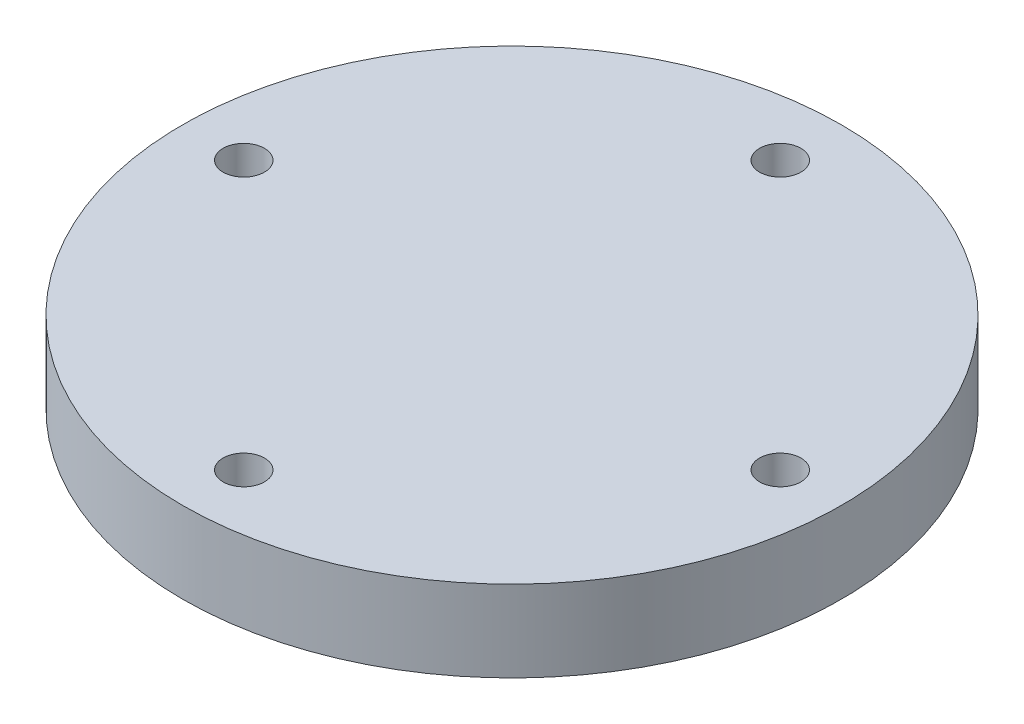
from build123d import *

# Parameters (mm, degrees)
SKETCH_1_R          = 21.5
EXTRUDE_1_DEPTH     = 5.3
CUT_EXTRUDE_1_REACH = 32.864
SKETCH_2_R          = 1.35


with BuildPart() as part:
    # 草图1 → 凸台-拉伸1 (new body)
    with BuildSketch(Plane(origin=(0, 0, 0), x_dir=(1, 0, 0), z_dir=(0, 1, 0))):
        with Locations(Location((0, 0, 0), (0, 0, 270))):
            Circle(SKETCH_1_R)
    extrude(amount=EXTRUDE_1_DEPTH)

    # 草图2 → 切除-拉伸1 (cut, up to next)
    with BuildSketch(Plane(origin=(0, 5.3, 0), x_dir=(1, 0, 0), z_dir=(0, 1, 0)), mode=Mode.PRIVATE) as cut_extrude_1_sk1:
        with Locations(Location((-17.5, 0, 0), (0, 0, 270))):
            Circle(SKETCH_2_R)
    cut_extrude_1_tool1 = extrude(cut_extrude_1_sk1.sketch, amount=-CUT_EXTRUDE_1_REACH, mode=Mode.PRIVATE) & part.part
    # 草图2 → 切除-拉伸1 (cut, up to next)
    with BuildSketch(Plane(origin=(0, 5.3, 0), x_dir=(1, 0, 0), z_dir=(0, 1, 0)), mode=Mode.PRIVATE) as cut_extrude_1_sk2:
        with Locations(Location((0, 17.5, 0), (0, 0, 270))):
            Circle(SKETCH_2_R)
    cut_extrude_1_tool2 = extrude(cut_extrude_1_sk2.sketch, amount=-CUT_EXTRUDE_1_REACH, mode=Mode.PRIVATE) & part.part
    # 草图2 → 切除-拉伸1 (cut, up to next)
    with BuildSketch(Plane(origin=(0, 5.3, 0), x_dir=(1, 0, 0), z_dir=(0, 1, 0)), mode=Mode.PRIVATE) as cut_extrude_1_sk3:
        with Locations(Location((17.5, 0, 0), (0, 0, 270))):
            Circle(SKETCH_2_R)
    cut_extrude_1_tool3 = extrude(cut_extrude_1_sk3.sketch, amount=-CUT_EXTRUDE_1_REACH, mode=Mode.PRIVATE) & part.part
    # 草图2 → 切除-拉伸1 (cut, up to next)
    with BuildSketch(Plane(origin=(0, 5.3, 0), x_dir=(1, 0, 0), z_dir=(0, 1, 0)), mode=Mode.PRIVATE) as cut_extrude_1_sk4:
        with Locations(Location((0, -17.5, 0), (0, 0, 270))):
            Circle(SKETCH_2_R)
    cut_extrude_1_tool4 = extrude(cut_extrude_1_sk4.sketch, amount=-CUT_EXTRUDE_1_REACH, mode=Mode.PRIVATE) & part.part
    add(cut_extrude_1_tool1.solids().sort_by_distance((-17.5, 5.3, 0))[0], mode=Mode.SUBTRACT)
    add(cut_extrude_1_tool2.solids().sort_by_distance((0, 5.3, -17.5))[0], mode=Mode.SUBTRACT)
    add(cut_extrude_1_tool3.solids().sort_by_distance((17.5, 5.3, 0))[0], mode=Mode.SUBTRACT)
    add(cut_extrude_1_tool4.solids().sort_by_distance((0, 5.3, 17.5))[0], mode=Mode.SUBTRACT)


solid = part.part
